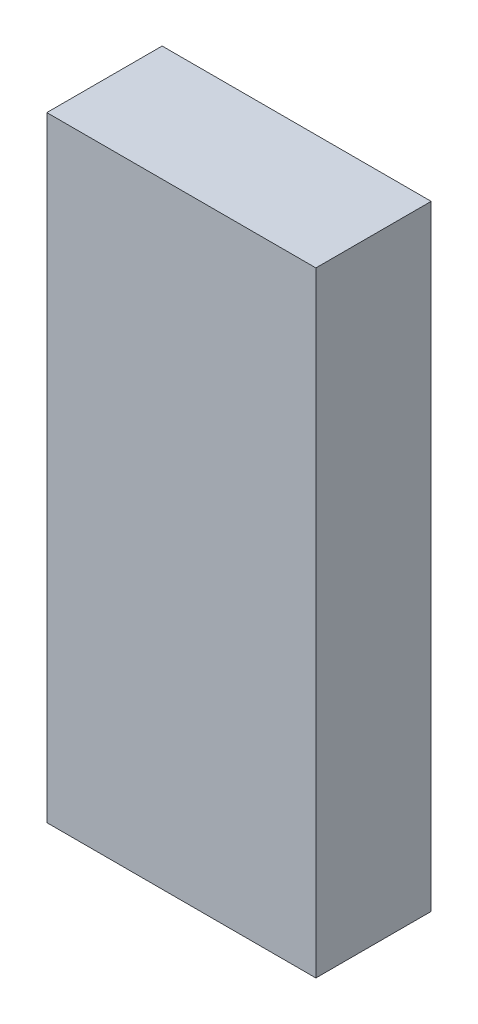
from build123d import *

# Parameters (mm, degrees)
SKETCH1_W           = 88.9
SKETCH1_H           = 38.1
BOSS_EXTRUDE1_DEPTH = 203.2


with BuildPart() as part:
    # Sketch1 → Boss-Extrude1 (new body)
    with BuildSketch(Plane(origin=(0, 0, 0), x_dir=(1, 0, 0), z_dir=(0, 1, 0))):
        with Locations((44.45, 19.05)):
            Rectangle(SKETCH1_W, SKETCH1_H)
    extrude(amount=BOSS_EXTRUDE1_DEPTH)


solid = part.part
